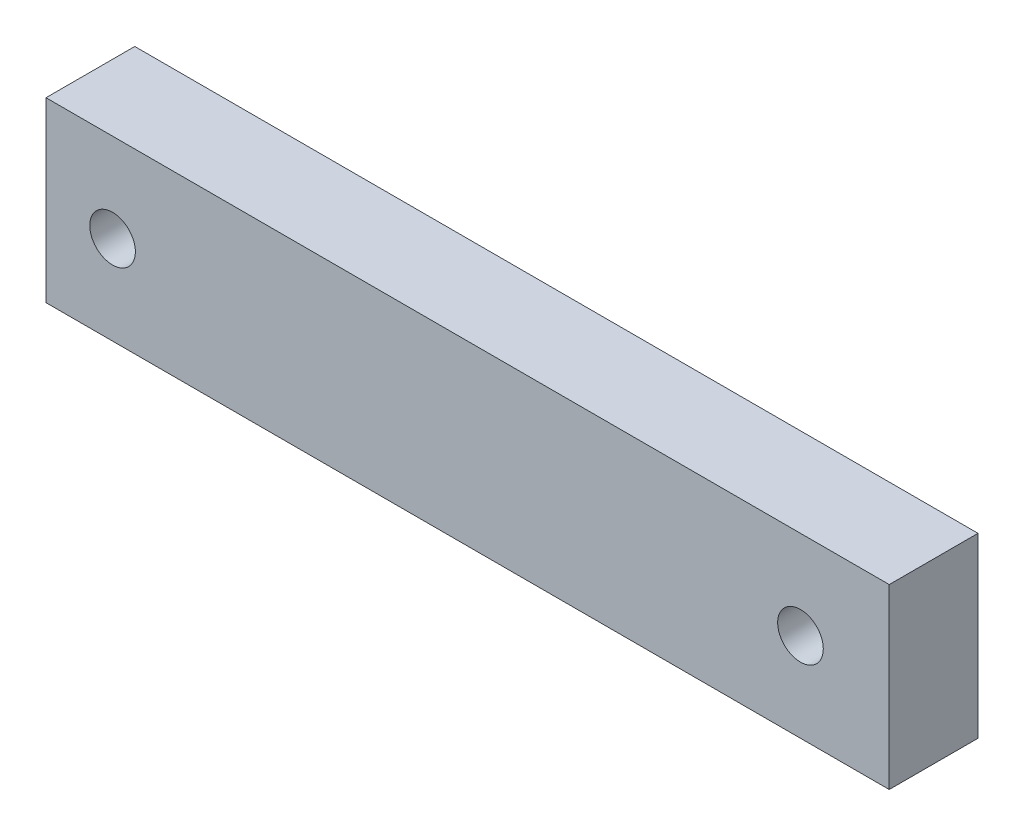
from build123d import *

# Parameters (mm, degrees)
SKETCH1_W                 = 60.325
SKETCH1_H                 = 12.7
BOSS_EXTRUDE1_DEPTH       = 6.35
F_4_CLEARANCE_HOLE1_D     = 3.2639
F_4_CLEARANCE_HOLE1_DEPTH = 12.7
F_4_CLEARANCE_HOLE1_TIP   = 0.980574487


with BuildPart() as part:
    # Sketch1 → Boss-Extrude1 (new body)
    with BuildSketch(Plane.XY):
        Rectangle(SKETCH1_W, SKETCH1_H)
    extrude(amount=BOSS_EXTRUDE1_DEPTH)

    # #4 Clearance Hole1
    with Locations(Plane.XY.offset(6.35)):
        with Locations((-25.4, 0), (23.8125, 0)):
            Hole(F_4_CLEARANCE_HOLE1_D / 2, depth=F_4_CLEARANCE_HOLE1_DEPTH)
            with Locations((0, 0, -(F_4_CLEARANCE_HOLE1_DEPTH + F_4_CLEARANCE_HOLE1_TIP / 2))):  # 118° drill point
                Cone(0, F_4_CLEARANCE_HOLE1_D / 2, F_4_CLEARANCE_HOLE1_TIP, mode=Mode.SUBTRACT)


solid = part.part
